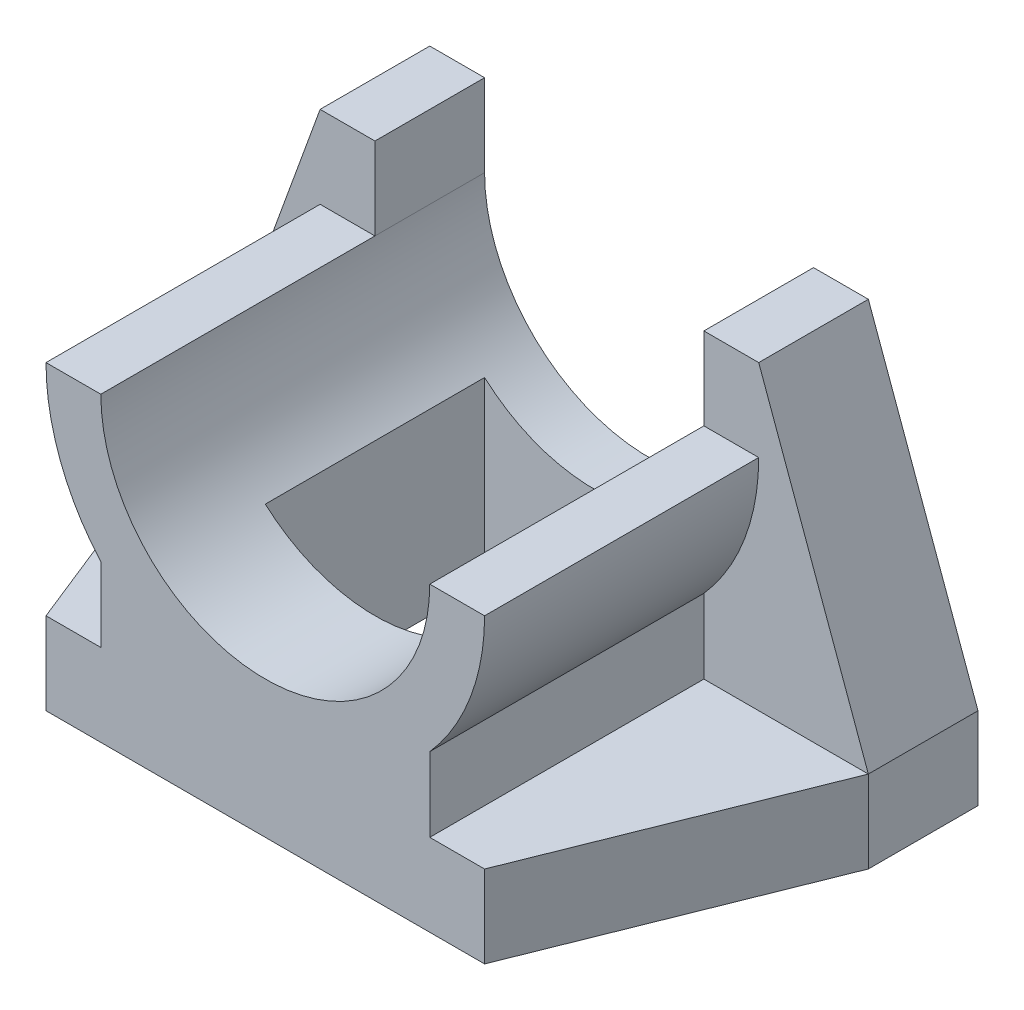
from build123d import *

# Parameters (mm, degrees)
SKETCH1_W           = 80
SKETCH1_H           = 70
BOSS_EXTRUDE1_DEPTH = 15
BOSS_EXTRUDE2_DEPTH = 70
BOSS_EXTRUDE3_DEPTH = 15
BOSS_EXTRUDE4_DEPTH = 20
CUT_EXTRUDE1_DEPTH  = 116.758369028
SKETCH6_W           = 40
SKETCH6_H           = 40
CUT_EXTRUDE2_DEPTH  = 116.758369028


with BuildPart() as part:
    # Sketch1 → Boss-Extrude1 (new body)
    with BuildSketch(Plane(origin=(0, 0, 0), x_dir=(1, 0, 0), z_dir=(0, 1, 0))):
        with Locations((0, -35)):
            Rectangle(SKETCH1_W, SKETCH1_H)
    extrude(amount=BOSS_EXTRUDE1_DEPTH)

    # Sketch2 → Boss-Extrude2 (add)
    with BuildSketch(Plane.XY):
        with BuildLine():
            Line((-30, 10), (30, 10))
            Line((30, 10), (30, 28.542486889))
            ThreePointArc((30, 28.542486889), (37.416573868, 40.857864376), (40, 55))
            Line((40, 55), (-40, 55))
            ThreePointArc((-40, 55), (-37.416573868, 40.857864376), (-30, 28.542486889))
            Line((-30, 28.542486889), (-30, 10))
        make_face()
    extrude(amount=BOSS_EXTRUDE2_DEPTH)

    # Sketch3 → Boss-Extrude3 (add)
    with BuildSketch(Plane(origin=(0, 0, 0), x_dir=(1, 0, 0), z_dir=(0, 1, 0))):
        Polygon((-60, 0), (-38, 0), (-38, -70), (-40, -70), (-60, -20), align=None)
    boss_extrude3 = extrude(amount=BOSS_EXTRUDE3_DEPTH)

    # Sketch4 → Boss-Extrude4 (add)
    with BuildSketch(Plane.XY):
        Polygon((-60, 15), (-30, 15), (-30, 70), (-40, 70), align=None)
    boss_extrude4 = extrude(amount=BOSS_EXTRUDE4_DEPTH)

    # Mirror1: Boss-Extrude3, Boss-Extrude4 across plane
    add(boss_extrude3.mirror(Plane(origin=(0, 0, 0), x_dir=(0, 0, 1), z_dir=(1, 0, 0))))
    add(boss_extrude4.mirror(Plane(origin=(0, 0, 0), x_dir=(0, 0, 1), z_dir=(1, 0, 0))))

    # Sketch5 → Cut-Extrude1 (cut, through all)
    with BuildSketch(Plane.XY):
        with BuildLine():
            Line((-30, 55), (30, 55))
            ThreePointArc((30, 55), (0, 25), (-30, 55))
        make_face()
    extrude(amount=CUT_EXTRUDE1_DEPTH, mode=Mode.SUBTRACT)

    # Sketch6 → Cut-Extrude2 (cut, through all)
    with BuildSketch(Plane(origin=(0, 0, 0), x_dir=(1, 0, 0), z_dir=(0, 1, 0))):
        with Locations((0, -30)):
            Rectangle(SKETCH6_W, SKETCH6_H)
    extrude(amount=CUT_EXTRUDE2_DEPTH, mode=Mode.SUBTRACT)


solid = part.part
